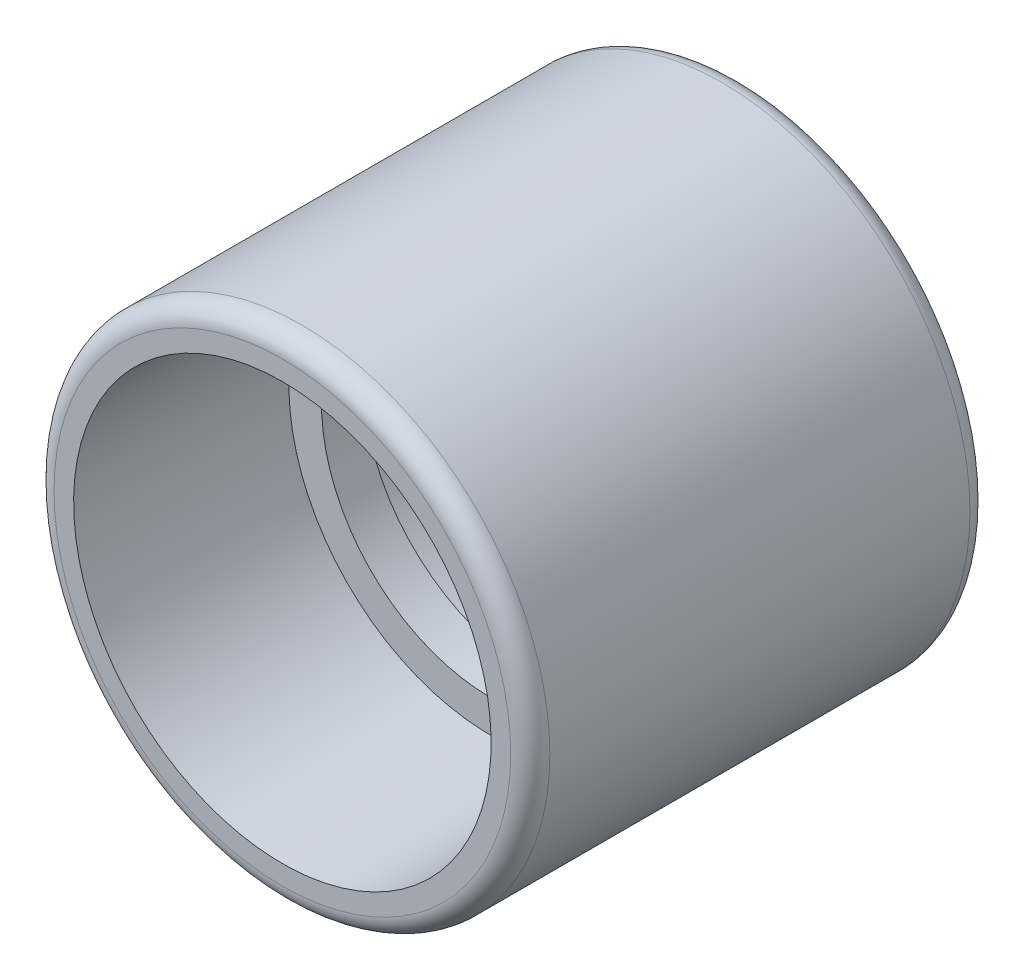
from build123d import *

# Parameters (mm, degrees)
BODYSCH_R  = 9.5
BODY_DEPTH = 8.8
FLOWSCH_R  = 6.5
FLOW_DEPTH = 17.6
FILLET1_R  = 0.75


with BuildPart() as part:
    # BodySch → Body (new, symmetric)
    with BuildSketch(Plane.XY):
        Circle(BODYSCH_R)
    extrude(amount=BODY_DEPTH, both=True)

    # FlowSch → Flow (cut)
    with BuildSketch(Plane.XY.offset(-8.8)):
        Circle(FLOWSCH_R)
    extrude(amount=FLOW_DEPTH, mode=Mode.SUBTRACT)

    # ThreadSch → Thread (revolve, cut)
    with BuildSketch(Plane(origin=(0, 0, 0), x_dir=(0, 0, -1), z_dir=(1, 0, 0))):
        Polygon((-0.8, 0), (-0.8, 7.750919254), (-8.8, 8), (-8.8, 0), align=None)
    thread = revolve(axis=Axis((0, 0, 0), (0, 0, 1)), mode=Mode.SUBTRACT)

    # Fillet1
    fillet1_edges = [part.edges().sort_by_distance(p)[0] for p in [
        (-9.5, 0, -8.8),
        (-9.5, 0, 8.8),
    ]]
    fillet(fillet1_edges, radius=FILLET1_R)

    # Mirror1: Thread across plane
    add(thread.mirror(Plane.XY), mode=Mode.SUBTRACT)


solid = part.part
